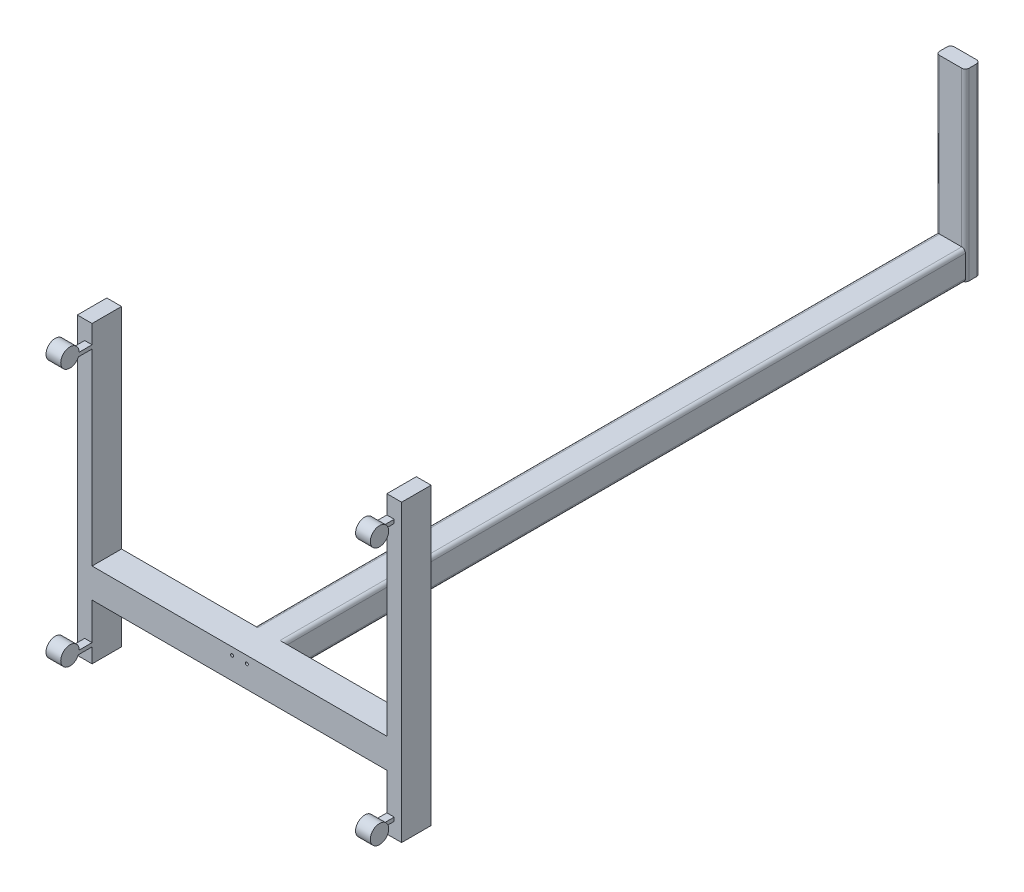
from build123d import *

# Parameters (mm, degrees)
SKETCH_1_W          = 800
SKETCH_1_H          = 80
EXTRUDE_1_DEPTH     = 80
SKETCH_2_W          = 80
SKETCH_2_H          = 80
EXTRUDE_2_DEPTH     = 1850
SKETCH_3_W          = 80
SKETCH_3_H          = 500
EXTRUDE_3_DEPTH     = 40
SKETCH_4_W          = 80
SKETCH_4_H          = 800
EXTRUDE_4_DEPTH     = 40
SKETCH_5_R          = 4
CUT_EXTRUDE_1_DEPTH = 40
SKETCH_7_R          = 4
CUT_EXTRUDE_2_DEPTH = 40
FILLET_1_R          = 10
FILLET_2_R          = 10
SKETCH_9_R          = 25
EXTRUDE_5_DEPTH     = 40
EXTRUDE_5_2_DEPTH   = 40
SKETCH_10_W         = 60
SKETCH_10_H         = 10
EXTRUDE_1_2_DEPTH   = 20


with BuildPart() as part:
    # 草图1 → Extrude 1 (new body)
    with BuildSketch(Plane.XY):
        Rectangle(SKETCH_1_W, SKETCH_1_H)
    extrude(amount=EXTRUDE_1_DEPTH)

    # 草图7 → 切除-拉伸2 (cut)
    with BuildSketch(Plane.XY.offset(80)):
        with Locations((-20, 20)):
            Circle(SKETCH_7_R)
        with Locations((20, 20)):
            Circle(SKETCH_7_R)
    extrude(amount=-CUT_EXTRUDE_2_DEPTH, mode=Mode.SUBTRACT)


with BuildPart() as body_2:
    # 草图2 → 凸台-拉伸2 (new body)
    with BuildSketch(Plane(origin=(0, 0, 0), x_dir=(-1, 0, 0), z_dir=(0, 0, -1))):
        Rectangle(SKETCH_2_W, SKETCH_2_H)
    extrude(amount=EXTRUDE_2_DEPTH)

    # 圆角1
    fillet_1_edges = [body_2.edges().sort_by_distance(p)[0] for p in [
        (40, 40, -925),
        (-40, 40, -925),
        (-40, -40, -925),
        (40, -40, -925),
    ]]
    fillet(fillet_1_edges, radius=FILLET_1_R)


with BuildPart() as body_3:
    # 草图3 → 凸台-拉伸3 (new body)
    with BuildSketch(Plane(origin=(0, 0, -1850), x_dir=(-1, 0, 0), z_dir=(0, 0, -1))):
        with Locations((0, 210)):
            Rectangle(SKETCH_3_W, SKETCH_3_H)
    extrude(amount=EXTRUDE_3_DEPTH)

    # 圆角2
    fillet_2_edges = [body_3.edges().sort_by_distance(p)[0] for p in [
        (-40, 210, -1890),
        (40, 210, -1890),
        (-40, 210, -1850),
        (40, 210, -1850),
    ]]
    fillet(fillet_2_edges, radius=FILLET_2_R)


with BuildPart() as body_4:
    # 草图4 → 凸台-拉伸4 (new body)
    with BuildSketch(Plane.ZY.offset(400)):
        with Locations((40, 210)):
            Rectangle(SKETCH_4_W, SKETCH_4_H)
    extrude(amount=EXTRUDE_4_DEPTH)


with BuildPart() as body_5:
    # 镜向2: mirrored copy
    add(body_4.part.mirror(Plane(origin=(0, 0, 0), x_dir=(0, 0, 1), z_dir=(1, 0, 0))))

    # 草图5 → 切除-拉伸1 (cut)
    with BuildSketch(Plane(origin=(440, 0, 0), x_dir=(0, 0, -1), z_dir=(1, 0, 0))):
        with Locations((-20, 20)):
            Circle(SKETCH_5_R)
        with Locations((-20, -20)):
            Circle(SKETCH_5_R)
    extrude(amount=-CUT_EXTRUDE_1_DEPTH, mode=Mode.SUBTRACT)


with BuildPart() as body_6:
    # 草图9 → 凸台-拉伸5 (new body)
    with BuildSketch(Plane.ZY.offset(440)):
        with Locations((140, 560)):
            Circle(SKETCH_9_R)
    extrude(amount=-EXTRUDE_5_DEPTH)


with BuildPart() as body_7:
    # 草图9 → Extrude 5 2 (new body)
    with BuildSketch(Plane.ZY.offset(440)):
        with Locations((140, -140)):
            Circle(SKETCH_9_R)
    extrude(amount=-EXTRUDE_5_2_DEPTH)


with BuildPart() as body_4_1:
    add(body_4.part)

    add(body_6.part)  # Extrude 1 2 merges body 6

    add(body_7.part)  # Extrude 1 2 merges body 7
    # 草图10 → Extrude 1 2 (add)
    with BuildSketch(Plane(origin=(-400, 0, 0), x_dir=(0, 0, -1), z_dir=(1, 0, 0))):
        with Locations((-110, 555)):
            Rectangle(SKETCH_10_W, SKETCH_10_H)
        with Locations((-110, -145)):
            Rectangle(SKETCH_10_W, SKETCH_10_H)
    extrude(amount=-EXTRUDE_1_2_DEPTH)


with BuildPart() as body_6_2:
    # 镜向6: mirrored copy
    add(body_4_1.part.mirror(Plane(origin=(0, 0, 0), x_dir=(0, 0, 1), z_dir=(1, 0, 0))))


with BuildPart() as part_1:
    add(part.part)

    # Combine 1: union body 5, body 6 2, body 2, body 4
    add(body_5.part)
    add(body_6_2.part)
    add(body_2.part)
    add(body_4_1.part)

    # Combine 2: union body 3
    add(body_3.part)


solid = part_1.part
